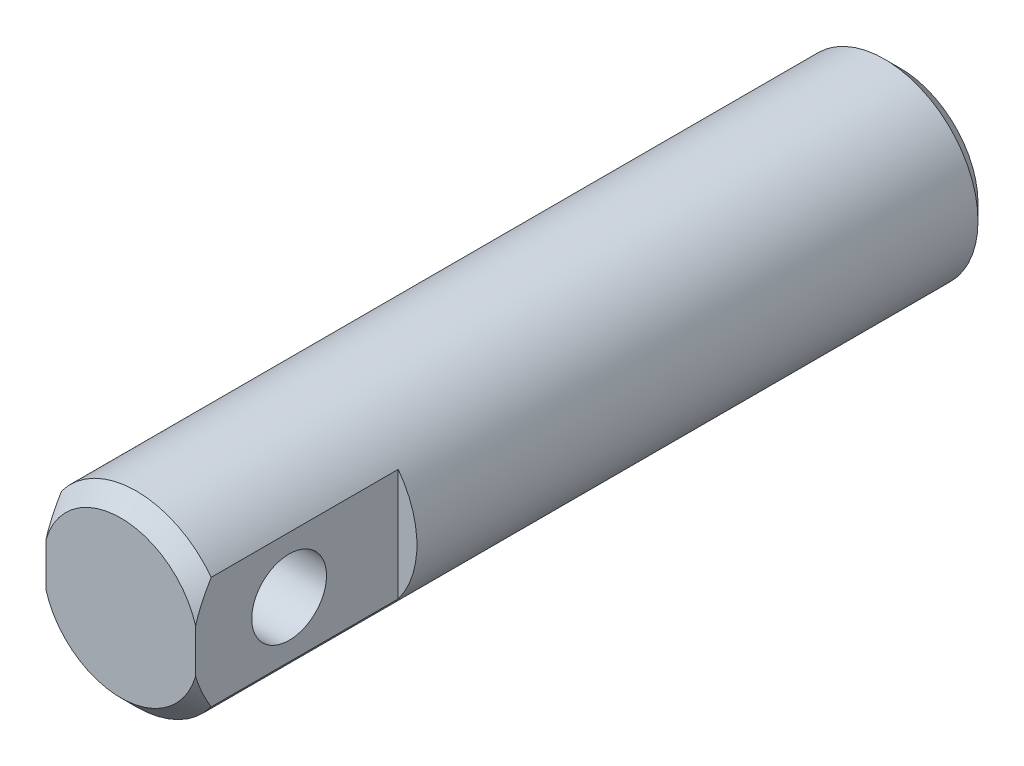
from build123d import *

# Parameters (mm, degrees)
ESQUISSE1_R             = 3
BASE_EXTRUSION_DEPTH    = 25
CHANFREIN2_SIZE         = 0.5
ESQUISSE2_W             = 2
ESQUISSE2_H             = 6
ENL_V_MAT_EXTRU_1_DEPTH = 6.5
ESQUISSE5_W             = 2
ESQUISSE5_H             = 6
ENL_V_MAT_EXTRU_3_DEPTH = 6.5
ESQUISSE4_R             = 1.2
ENL_V_MAT_EXTRU_2_DEPTH = 26.751893134
ENL_V_MAT_EXTRU_4_DEPTH = 3.5


with BuildPart() as part:
    # Esquisse1 → Base-Extrusion (new body)
    with BuildSketch(Plane.XY):
        with Locations(Location((0, 0, 0), (0, 0, 216.869897646))):
            Circle(ESQUISSE1_R)
    extrude(amount=BASE_EXTRUSION_DEPTH)

    # Chanfrein2
    chanfrein2_edges = [part.edges().sort_by_distance(p)[0] for p in [
        (2.4, 1.8, 0),
        (2.4, 1.8, 25),
    ]]
    chamfer(chanfrein2_edges, length=CHANFREIN2_SIZE)

    # Esquisse2 → Enlèv. mat.-Extru.1 (cut)
    with BuildSketch(Plane.XY.offset(25)):
        with Locations((3.4, 0)):
            Rectangle(ESQUISSE2_W, ESQUISSE2_H)
    extrude(amount=-ENL_V_MAT_EXTRU_1_DEPTH, mode=Mode.SUBTRACT)

    # Esquisse5 → Enlèv. mat.-Extru.3 (cut)
    with BuildSketch(Plane.XY.offset(25)):
        with Locations((-3.4, 0)):
            Rectangle(ESQUISSE5_W, ESQUISSE5_H)
    extrude(amount=-ENL_V_MAT_EXTRU_3_DEPTH, mode=Mode.SUBTRACT)

    # Esquisse4 → Enlèv. mat.-Extru.2 (cut, through all)
    with BuildSketch(Plane(origin=(2.4, 0, 0), x_dir=(0, 0, -1), z_dir=(1, 0, 0))):
        with Locations(Location((-22, 0, 0), (0, 0, 90))):
            Circle(ESQUISSE4_R)
    extrude(amount=-ENL_V_MAT_EXTRU_2_DEPTH, mode=Mode.SUBTRACT)

    # Esquisse6 → Enlèv. mat.-Extru.4 (cut)
    with BuildSketch(Plane(origin=(0, 0, 0), x_dir=(-1, 0, 0), z_dir=(0, 0, -1))):
        Polygon((-2, 0), (-0.999257658, 1.732479187), (0.999257658, 1.732479187), (2, 0), (0.999257658, -1.732479187), (-0.999257658, -1.732479187), align=None)
    extrude(amount=-ENL_V_MAT_EXTRU_4_DEPTH, mode=Mode.SUBTRACT)


solid = part.part
